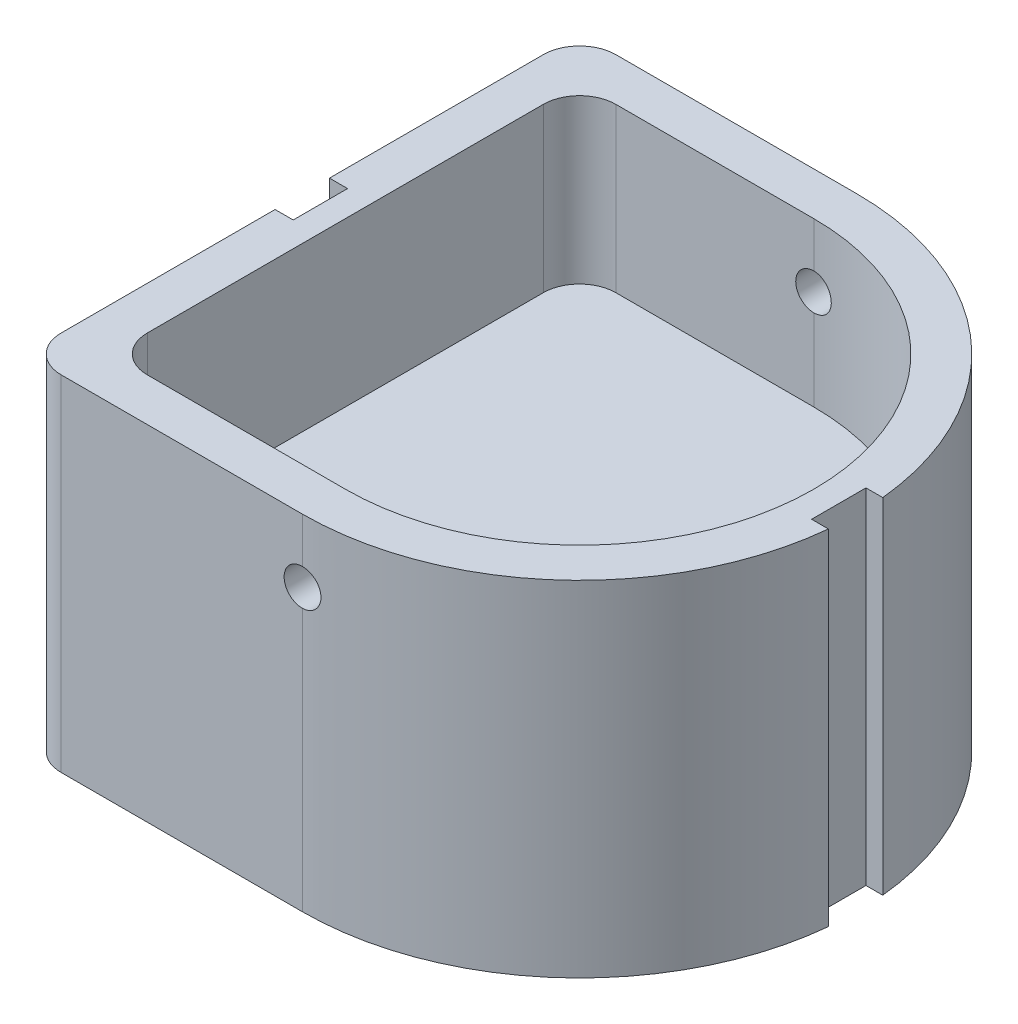
from build123d import *

# Parameters (mm, degrees)
BOSS_EXTRUDE1_DEPTH     = 19
CUT_EXTRUDE1_DEPTH      = 9
CUT_EXTRUDE2_DEPTH      = 29.795485757
CUT_EXTRUDE2_DEPTH_BACK = 29.795485757
SKETCH3_R               = 1
SKETCH8_W               = 1
SKETCH8_H               = 3
CUT_EXTRUDE9_DEPTH      = 29.79548593


with BuildPart() as part:
    # Sketch1 → Boss-Extrude1 (new body)
    with BuildSketch(Plane(origin=(0, 0, 0), x_dir=(1, 0, 0), z_dir=(0, 1, 0))):
        with BuildLine():
            Line((-13.3, 15.3), (0, 15.3))
            ThreePointArc((0, 15.3), (15.3, 0), (0, -15.3))
            Line((0, -15.3), (-13.3, -15.3))
            ThreePointArc((-13.3, -15.3), (-14.714213562, -14.714213562), (-15.3, -13.3))
            Line((-15.3, -13.3), (-15.3, 13.3))
            ThreePointArc((-15.3, 13.3), (-14.714213562, 14.714213562), (-13.3, 15.3))
        make_face()
    extrude(amount=BOSS_EXTRUDE1_DEPTH)

    # Sketch2 → Cut-Extrude1 (cut)
    with BuildSketch(Plane(origin=(0, 19, 0), x_dir=(1, 0, 0), z_dir=(0, 1, 0))):
        with BuildLine():
            Line((-10.925, 12.925), (0, 12.925))
            ThreePointArc((0, 12.925), (12.925, 0), (0, -12.925))
            Line((0, -12.925), (-10.925, -12.925))
            ThreePointArc((-10.925, -12.925), (-12.339213562, -12.339213562), (-12.925, -10.925))
            Line((-12.925, -10.925), (-12.925, 10.925))
            ThreePointArc((-12.925, 10.925), (-12.339213562, 12.339213562), (-10.925, 12.925))
        make_face()
    extrude(amount=-CUT_EXTRUDE1_DEPTH, mode=Mode.SUBTRACT)

    # Sketch3 → Cut-Extrude2 (cut, two sides: drawn at the far end of the back side and taken through both)
    with BuildSketch(Plane.XY.offset(-CUT_EXTRUDE2_DEPTH_BACK)):
        with Locations(Location((0, 15.5, 0), (0, 0, 90))):
            Circle(SKETCH3_R)
    extrude(amount=CUT_EXTRUDE2_DEPTH + CUT_EXTRUDE2_DEPTH_BACK, mode=Mode.SUBTRACT)

    # Sketch8 → Cut-Extrude9 (cut, through all)
    with BuildSketch(Plane(origin=(0, 0, 0), x_dir=(1, 0, 0), z_dir=(0, 1, 0))):
        with Locations((14.8, 0)):
            Rectangle(SKETCH8_W, SKETCH8_H)
        with Locations((-14.8, 0)):
            Rectangle(SKETCH8_W, SKETCH8_H)
    extrude(amount=CUT_EXTRUDE9_DEPTH, mode=Mode.SUBTRACT)


solid = part.part
